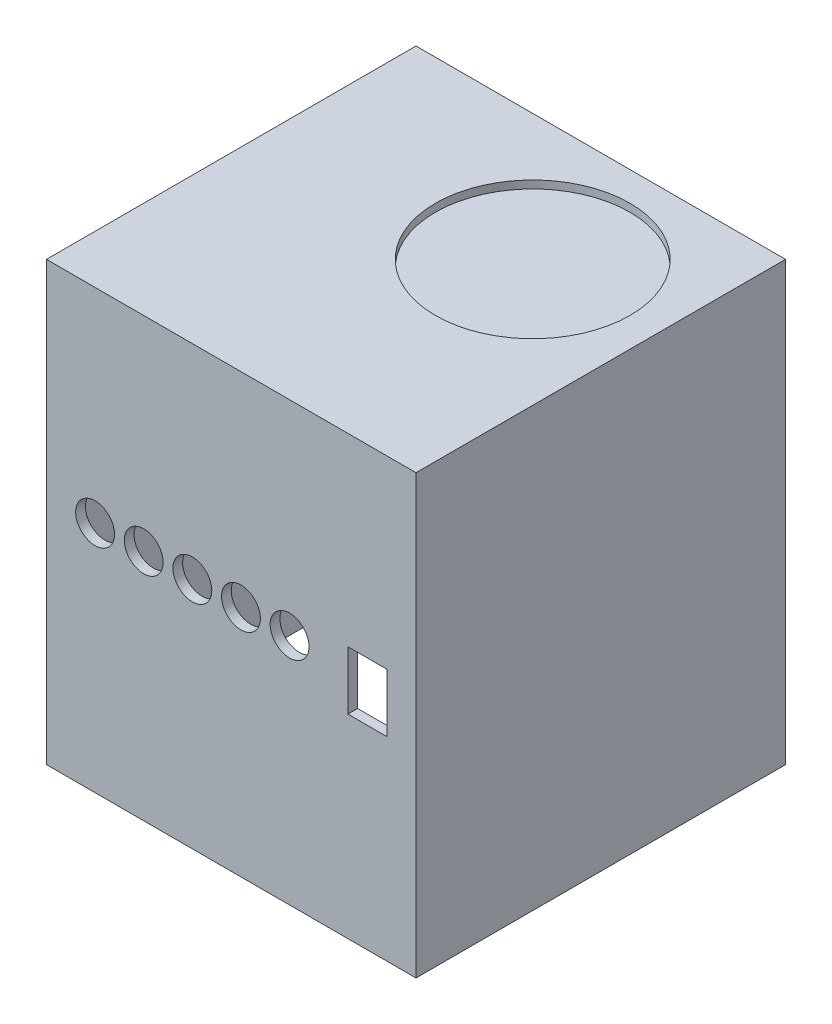
from build123d import *

# Parameters (mm, degrees)
SKETCH2_W           = 90
SKETCH2_H           = 90
BOSS_EXTRUDE2_DEPTH = 110
SHELL2_T            = 2.5
SKETCH3_R           = 5
SKETCH3_W           = 10
SKETCH3_H           = 15
CUT_EXTRUDE1_DEPTH  = 10
SKETCH4_R           = 25
CUT_EXTRUDE2_DEPTH  = 2


with BuildPart() as part:
    # Sketch2 → Boss-Extrude2 (new body)
    with BuildSketch(Plane(origin=(0, 0, 0), x_dir=(1, 0, 0), z_dir=(0, 1, 0))):
        Rectangle(SKETCH2_W, SKETCH2_H)
    extrude(amount=BOSS_EXTRUDE2_DEPTH)

    # Shell2
    shell2_openings = [part.faces().sort_by_distance(p)[0] for p in [
        (0, 0, 0),
    ]]
    offset(amount=SHELL2_T, openings=shell2_openings, kind=Kind.INTERSECTION)

    # Sketch3 → Cut-Extrude1 (cut)
    with BuildSketch(Plane.XY.offset(47.5)):
        with Locations((-35, 60)):
            Circle(SKETCH3_R)
        with Locations((-22.5, 60)):
            Circle(SKETCH3_R)
        with Locations((-10, 60)):
            Circle(SKETCH3_R)
        with Locations((2.5, 60)):
            Circle(SKETCH3_R)
        with Locations((15, 60)):
            Circle(SKETCH3_R)
        with Locations((35, 57.5)):
            Rectangle(SKETCH3_W, SKETCH3_H)
    extrude(amount=-CUT_EXTRUDE1_DEPTH, mode=Mode.SUBTRACT)

    # Sketch4 → Cut-Extrude2 (cut)
    with BuildSketch(Plane(origin=(0, 112.5, 0), x_dir=(1, 0, 0), z_dir=(0, 1, 0))):
        with Locations(Location((15, 15, 0), (0, 0, 270))):
            Circle(SKETCH4_R)
    extrude(amount=-CUT_EXTRUDE2_DEPTH, mode=Mode.SUBTRACT)


solid = part.part
